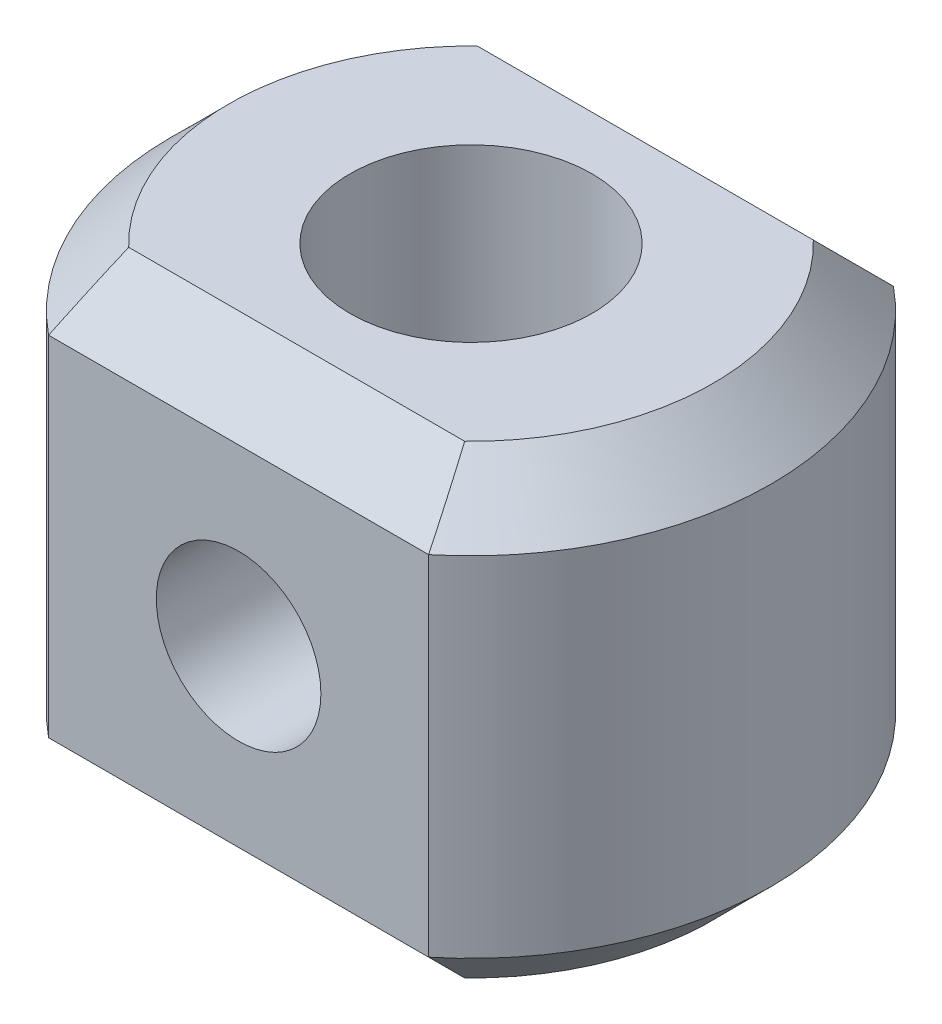
from build123d import *

# Parameters (mm, degrees)
SKETCH2_R               = 12.5
BOSS_EXTRUDE1_DEPTH     = 24
CUT_EXTRUDE1_DEPTH      = 46.967379738
CUT_EXTRUDE1_DEPTH_BACK = 46.967379738
SKETCH1_R               = 8.5
CHAMFER1_SIZE           = 6


with BuildPart() as part:
    # Sketch2 → Boss-Extrude1 (new, symmetric)
    with BuildSketch(Plane(origin=(0, 0, 0), x_dir=(1, 0, 0), z_dir=(0, 1, 0))):
        with BuildLine():
            Line((-19.62141687, 24), (19.62141687, 24))
            ThreePointArc((19.62141687, 24), (31, 0), (19.62141687, -24))
            Line((19.62141687, -24), (-19.62141687, -24))
            ThreePointArc((-19.62141687, -24), (-31, 0), (-19.62141687, 24))
        make_face()
        with Locations(Location((0, 0, 0), (0, 0, 270))):
            Circle(SKETCH2_R, mode=Mode.SUBTRACT)
    extrude(amount=BOSS_EXTRUDE1_DEPTH, both=True)

    # Sketch1 → Cut-Extrude1 (cut, two sides: drawn at the far end of the back side and taken through both)
    with BuildSketch(Plane.XY.offset(-CUT_EXTRUDE1_DEPTH_BACK)):
        Circle(SKETCH1_R)
    extrude(amount=CUT_EXTRUDE1_DEPTH + CUT_EXTRUDE1_DEPTH_BACK, mode=Mode.SUBTRACT)

    # Chamfer1
    chamfer1_edges = [part.edges().sort_by_distance(p)[0] for p in [
        (31, 24, 0),
        (0, 24, -24),
        (-31, 24, 0),
        (0, -24, -24),
        (31, -24, 0),
        (0, -24, 24),
        (-31, -24, 0),
        (0, 24, 24),
    ]]
    chamfer(chamfer1_edges, length=CHAMFER1_SIZE)


solid = part.part
